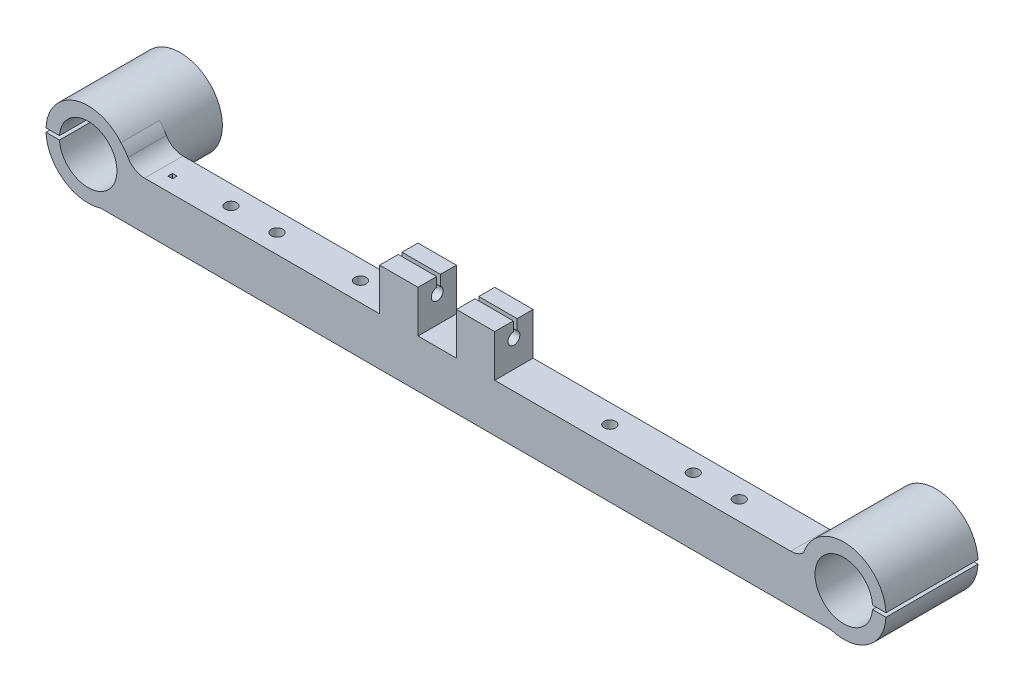
from build123d import *
from build123d.topology import SkipClean

# Parameters (mm, degrees)
SKETCH2_R           = 7.5
BOSS_EXTRUDE1_DEPTH = 10
FILLET1_R           = 5
BOSS_EXTRUDE2_START = -24
SKETCH3_R           = 11
SKETCH3_R_2         = 7.5
BOSS_EXTRUDE2_DEPTH = 24
CUT_EXTRUDE1_REACH  = 135.566
SKETCH4_R           = 1.55
SKETCH6_W           = 37.11251069
SKETCH6_H           = 1
CUT_EXTRUDE3_DEPTH  = 10
SKETCH7_W           = 36.737317401
SKETCH7_H           = 1
CUT_EXTRUDE4_DEPTH  = 3
FILLET2_R           = 5
SKETCH8_R           = 1.5
CUT_EXTRUDE5_DEPTH  = 7
SKETCH9_W           = 1.241983996
SKETCH9_H           = 1.188202975
CUT_EXTRUDE6_DEPTH  = 1


with BuildPart() as part:
    # Sketch2 → Boss-Extrude1 (new body)
    with BuildSketch(Plane.XY):
        with BuildLine():
            Line((-22.5, 3.831552556), (-22.5, 14.831552556))
            Line((-22.5, 14.831552556), (-12.5, 14.831552556))
            Line((-12.5, 14.831552556), (-12.5, 3.831552556))
            Line((-12.5, 3.831552556), (-2.5, 3.831552556))
            Line((-2.5, 3.831552556), (-2.5, 14.831552556))
            Line((-2.5, 14.831552556), (7.5, 14.831552556))
            Line((7.5, 14.831552556), (7.5, 3.831552556))
            Line((7.5, 3.831552556), (88.192235936, 3.831552556))
            ThreePointArc((88.192235936, 3.831552556), (91.819805392, 9.932478429), (98.5, 12.331552556))
            ThreePointArc((98.5, 12.331552556), (109, 1.831552556), (98.5, -8.668447444))
            Line((98.5, -8.668447444), (-98.5, -8.668447444))
            ThreePointArc((-98.5, -8.668447444), (-109, 1.831552556), (-98.5, 12.331552556))
            ThreePointArc((-98.5, 12.331552556), (-91.358571571, 9.975203317), (-87.021759717, 3.831552556))
            Line((-87.021759717, 3.831552556), (-22.5, 3.831552556))
        make_face()
        with Locations((-98.5, 1.831552556)):
            Circle(SKETCH2_R, mode=Mode.SUBTRACT)
        with Locations((98.5, 1.831552556)):
            Circle(SKETCH2_R, mode=Mode.SUBTRACT)
    extrude(amount=BOSS_EXTRUDE1_DEPTH)

    # Fillet1
    fillet1_edges = [part.edges().sort_by_distance(p)[0] for p in [
        (88.192235936, 3.831552556, 5),
    ]]
    fillet(fillet1_edges, radius=FILLET1_R)

    # Sketch3 → Boss-Extrude2 (add)
    with BuildSketch(Plane.XY.offset(10).offset(BOSS_EXTRUDE2_START)):
        with Locations((-98.5, 1.831552556)):
            Circle(SKETCH3_R)
        with Locations((-98.5, 1.831552556)):
            Circle(SKETCH3_R_2, mode=Mode.SUBTRACT)
    boss_extrude2 = extrude(amount=BOSS_EXTRUDE2_DEPTH)

    # Mirror1: Boss-Extrude2 across plane
    with SkipClean():  # the faces are left unmerged after this step: merging them gives an invalid solid
        add(boss_extrude2.mirror(Plane(origin=(0, 0, 0), x_dir=(0, 0, 1), z_dir=(1, 0, 0))))

    # Cut-Extrude1: up to this face of the body (flat: up to its plane)
    cut_extrude1_end = Plane(part.part.faces().sort_by_distance((7.5, 9.331552556, 5))[0])
    # Sketch4 → Cut-Extrude1 (cut, up to the picked face)
    with BuildSketch(Plane.ZY.offset(22.5), mode=Mode.PRIVATE) as cut_extrude1_sk1:
        with Locations((5, 10.805752832)):
            Circle(SKETCH4_R)
    cut_extrude1_tool1 = split(extrude(cut_extrude1_sk1.sketch, amount=-CUT_EXTRUDE1_REACH, mode=Mode.PRIVATE), bisect_by=cut_extrude1_end, keep=Keep.BOTH, mode=Mode.PRIVATE)
    add(cut_extrude1_tool1.solids().sort_by(Axis((-22.5, 10.805753, 5), (1, 0, 0)))[0], mode=Mode.SUBTRACT)

    # Sketch6 → Cut-Extrude3 (cut)
    with BuildSketch(Plane(origin=(110, 0, 0), x_dir=(0, 0, -1), z_dir=(1, 0, 0))):
        with Locations((1.381927251, 1.831552556)):
            Rectangle(SKETCH6_W, SKETCH6_H)
    cut_extrude3 = extrude(amount=-CUT_EXTRUDE3_DEPTH, mode=Mode.SUBTRACT)

    # Mirror2: Cut-Extrude3 across plane
    add(cut_extrude3.mirror(Plane(origin=(0, 0, 0), x_dir=(0, 0, 1), z_dir=(1, 0, 0))), mode=Mode.SUBTRACT)

    # Sketch7 → Cut-Extrude4 (cut)
    with BuildSketch(Plane(origin=(0, 14.831552556, 0), x_dir=(1, 0, 0), z_dir=(0, 1, 0))):
        with Locations((-7.879171978, -4.654369626)):
            Rectangle(SKETCH7_W, SKETCH7_H)
    extrude(amount=-CUT_EXTRUDE4_DEPTH, mode=Mode.SUBTRACT)

    # Fillet2
    fillet2_edges = [part.edges().sort_by_distance(p)[0] for p in [
        (-87.021759717, 3.831552556, 5),
    ]]
    fillet(fillet2_edges, radius=FILLET2_R)

    # Sketch8 → Cut-Extrude5 (cut)
    with BuildSketch(Plane(origin=(0, 3.831552556, 0), x_dir=(1, 0, 0), z_dir=(0, 1, 0))):
        with Locations(Location((-66.25676189, -5, 0), (0, 0, 270))):
            Circle(SKETCH8_R)
        with Locations(Location((-54.25676189, -5, 0), (0, 0, 270))):
            Circle(SKETCH8_R)
        with Locations(Location((-32.502764064, -5, 0), (0, 0, 270))):
            Circle(SKETCH8_R)
        with Locations(Location((32.497235936, -5, 0), (0, 0, 270))):
            Circle(SKETCH8_R)
        with Locations(Location((54.24523811, -5, 0), (0, 0, 270))):
            Circle(SKETCH8_R)
        with Locations(Location((66.24523811, -5, 0), (0, 0, 270))):
            Circle(SKETCH8_R)
    extrude(amount=-CUT_EXTRUDE5_DEPTH, mode=Mode.SUBTRACT)

    # Sketch9 → Cut-Extrude6 (cut)
    with BuildSketch(Plane(origin=(0, 3.831552556, 0), x_dir=(1, 0, 0), z_dir=(0, 1, 0))):
        with Locations((-80.613746542, -5.894733375)):
            Rectangle(SKETCH9_W, SKETCH9_H)
    extrude(amount=-CUT_EXTRUDE6_DEPTH, mode=Mode.SUBTRACT)


solid = part.part
